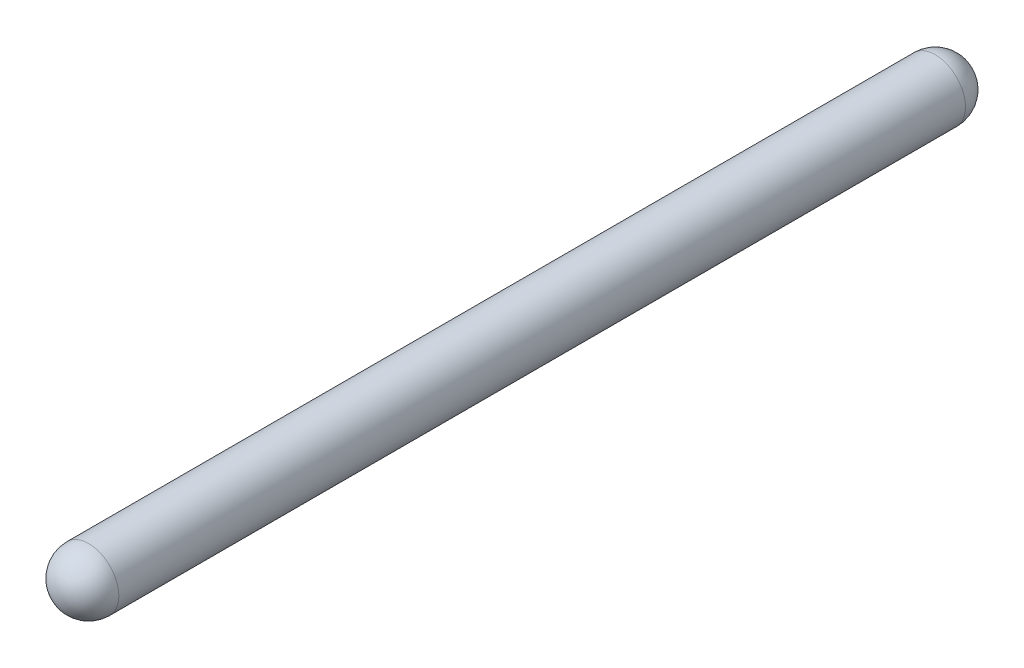
from build123d import *

# Parameters (mm, degrees)
SKETCH2_R           = 1
BOSS_EXTRUDE4_DEPTH = 30
FILLET2_R           = 1
ESCALA1_SCALE       = 0.5


with BuildPart() as part:
    # Sketch2 → Boss-Extrude4 (new body)
    with BuildSketch(Plane.XY):
        Circle(SKETCH2_R)
    extrude(amount=BOSS_EXTRUDE4_DEPTH)

    # Fillet2
    fillet2_edges = [part.edges().sort_by_distance(p)[0] for p in [
        (-1, 0, 0),
        (-1, 0, 30),
    ]]
    fillet(fillet2_edges, radius=FILLET2_R)


with BuildPart() as part_1:
    # Escala1: scaled about (0, 0, 15)
    add(part.part.scale(ESCALA1_SCALE).moved(Location((0, 0, 7.5))))


solid = part_1.part
